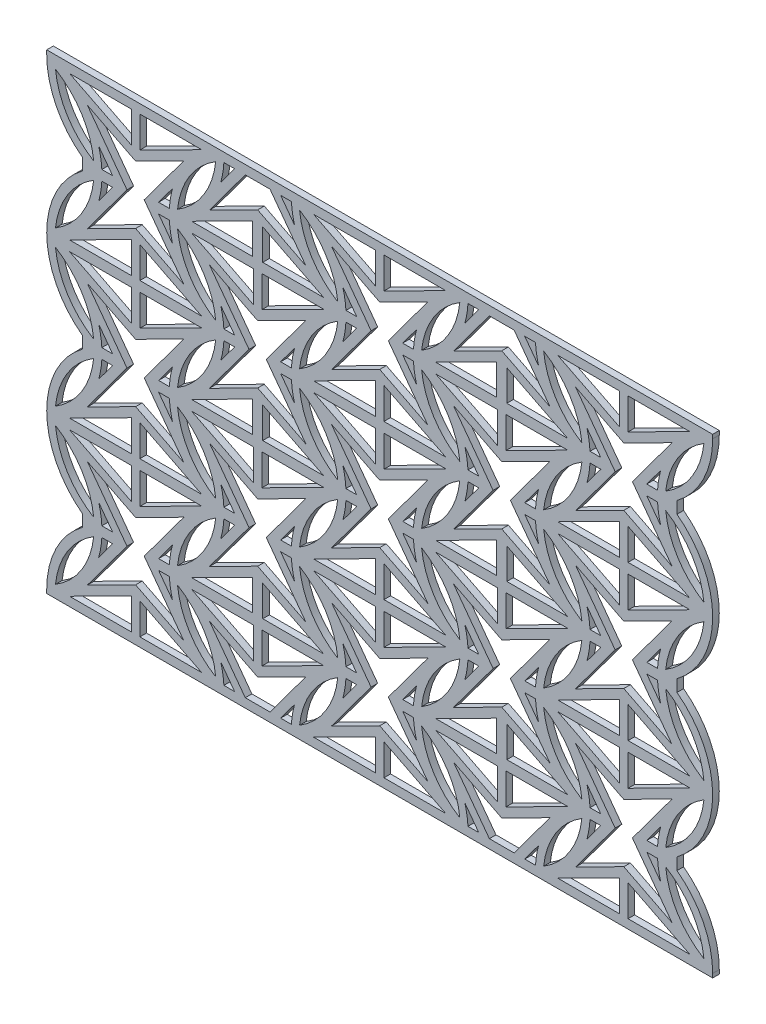
from build123d import *

# Parameters (mm, degrees)
BOSS_EXTRUDE1_DEPTH = 1.2


with BuildPart() as part:
    # Sketch1 → Boss-Extrude1 (new body)
    with BuildSketch(Plane.XY):
        with BuildLine():
            Line((-15.727929803, -12.952946495), (-15.727929803, -13.669398148))
            Line((-15.727929803, -13.669398148), (16.472070197, -13.669398148))
            Line((16.472070197, -13.669398148), (28.486967137, -13.669398148))
            Line((28.486967137, -13.669398148), (60.686967137, -13.669398148))
            Line((60.686967137, -13.669398148), (72.701864078, -13.669398148))
            Line((72.701864078, -13.669398148), (104.901864078, -13.669398148))
            Line((104.901864078, -13.669398148), (104.901864078, -12.952946495))
            ThreePointArc((104.901864078, -12.952946495), (103.196137283, -5.740810966), (98.440385953, -0.056865849))
            Line((98.440385953, -0.056865849), (98.440385953, 2.103251931))
            ThreePointArc((98.440385953, 2.103251931), (103.196137283, 7.787197048), (104.901864078, 14.999332578))
            ThreePointArc((104.901864078, 14.999332578), (103.196137283, 22.211468108), (98.440385953, 27.895413225))
            Line((98.440385953, 27.895413225), (98.440385953, 30.055531005))
            ThreePointArc((98.440385953, 30.055531005), (103.196137283, 35.739476122), (104.901864078, 42.951611652))
            ThreePointArc((104.901864078, 42.951611652), (103.196137283, 50.163747182), (98.440385953, 55.847692299))
            Line((98.440385953, 55.847692299), (98.440385953, 58.007810079))
            ThreePointArc((98.440385953, 58.007810079), (103.196137283, 63.691755196), (104.901864078, 70.903890726))
            Line((104.901864078, 70.903890726), (104.901864078, 71.620342378))
            Line((104.901864078, 71.620342378), (72.701864078, 71.620342378))
            Line((72.701864078, 71.620342378), (60.686967137, 71.620342378))
            Line((60.686967137, 71.620342378), (28.486967137, 71.620342378))
            Line((28.486967137, 71.620342378), (16.472070197, 71.620342378))
            Line((16.472070197, 71.620342378), (-15.727929803, 71.620342378))
            Line((-15.727929803, 71.620342378), (-15.727929803, 70.903890726))
            ThreePointArc((-15.727929803, 70.903890726), (-14.022203008, 63.691755196), (-9.266451679, 58.007810079))
            Line((-9.266451679, 58.007810079), (-9.266451679, 55.847692299))
            ThreePointArc((-9.266451679, 55.847692299), (-14.022203008, 50.163747182), (-15.727929803, 42.951611652))
            ThreePointArc((-15.727929803, 42.951611652), (-14.022203008, 35.739476122), (-9.266451679, 30.055531005))
            Line((-9.266451679, 30.055531005), (-9.266451679, 27.895413225))
            ThreePointArc((-9.266451679, 27.895413225), (-14.022203008, 22.211468108), (-15.727929803, 14.999332578))
            ThreePointArc((-15.727929803, 14.999332578), (-14.022203008, 7.787197048), (-9.266451679, 2.103251931))
            Line((-9.266451679, 2.103251931), (-9.266451679, -0.056865849))
            ThreePointArc((-9.266451679, -0.056865849), (-14.022203008, -5.740810966), (-15.727929803, -12.952946495))
        make_face()
        with BuildLine():
            Line((4.538204286, 0.10466102), (6.487112113, 0.10466102))
            ThreePointArc((6.487112113, 0.10466102), (6.678500428, -1.609028658), (7.052983066, -3.292217463))
            Line((7.052983066, -3.292217463), (4.538204286, 0.10466102))
        make_face(mode=Mode.SUBTRACT)
        with BuildLine():
            Line((-3.794063892, 0.10466102), (-5.742971719, 0.10466102))
            ThreePointArc((-5.742971719, 0.10466102), (-5.934360034, -1.609028658), (-6.308842672, -3.292217463))
            Line((-6.308842672, -3.292217463), (-3.794063892, 0.10466102))
        make_face(mode=Mode.SUBTRACT)
        with BuildLine():
            Line((-3.794063892, 1.941725063), (-6.308842672, 5.338603546))
            ThreePointArc((-6.308842672, 5.338603546), (-5.934360034, 3.655414741), (-5.742971719, 1.941725063))
            Line((-5.742971719, 1.941725063), (-3.794063892, 1.941725063))
        make_face(mode=Mode.SUBTRACT)
        Polygon((12.336113287, 14.080800557), (1.145509973, 14.080800557), (1.145509973, 8.42883026), align=None, mode=Mode.SUBTRACT)
        with BuildLine():
            Line((4.538204286, 1.941725063), (7.052983066, 5.338603546))
            ThreePointArc((7.052983066, 5.338603546), (6.678500428, 3.655414741), (6.487112113, 1.941725063))
            Line((6.487112113, 1.941725063), (4.538204286, 1.941725063))
        make_face(mode=Mode.SUBTRACT)
        Polygon((-0.401369579, 8.42883026), (-11.591972894, 14.080800557), (-0.401369579, 14.080800557), align=None, mode=Mode.SUBTRACT)
        Polygon((0.372070197, 6.305212458), (9.111793427, 10.719331582), (1.933543286, 1.023193041), (9.111793427, -8.6729455), (0.372070197, -4.258826375), (-8.367653033, -8.6729455), (-1.189402892, 1.023193041), (-8.367653033, 10.719331582), align=None, mode=Mode.SUBTRACT)
        Polygon((21.706078891, 22.404969797), (10.515475577, 28.056940094), (21.706078891, 28.056940094), align=None, mode=Mode.SUBTRACT)
        Polygon((22.479518667, 20.281351995), (13.739795437, 24.695471119), (20.918045578, 14.999332578), (13.739795437, 5.303194037), (22.479518667, 9.717313161), (31.219241897, 5.303194037), (24.040991756, 14.999332578), (31.219241897, 24.695471119), align=None, mode=Mode.SUBTRACT)
        with BuildLine():
            Line((26.645652756, 15.9178646), (29.160431536, 19.314743083))
            ThreePointArc((29.160431536, 19.314743083), (28.785948898, 17.631554278), (28.594560583, 15.9178646))
            Line((28.594560583, 15.9178646), (26.645652756, 15.9178646))
        make_face(mode=Mode.SUBTRACT)
        with BuildLine():
            Line((18.313384578, 15.9178646), (15.798605798, 19.314743083))
            ThreePointArc((15.798605798, 19.314743083), (16.173088436, 17.631554278), (16.364476751, 15.9178646))
            Line((16.364476751, 15.9178646), (18.313384578, 15.9178646))
        make_face(mode=Mode.SUBTRACT)
        Polygon((23.402958443, 7.517935768), (34.443561758, 1.941725063), (23.402958443, 1.941725063), align=None, mode=Mode.SUBTRACT)
        with BuildLine():
            Line((18.313384578, 14.080800557), (16.364476751, 14.080800557))
            ThreePointArc((16.364476751, 14.080800557), (16.173088436, 12.367110879), (15.798605798, 10.683922074))
            Line((15.798605798, 10.683922074), (18.313384578, 14.080800557))
        make_face(mode=Mode.SUBTRACT)
        Polygon((21.556078891, 2.103251931), (21.556078891, 1.941725063), (10.515475577, 1.941725063), (21.556078891, 7.517935768), align=None, mode=Mode.SUBTRACT)
        with BuildLine():
            Line((26.645652756, 14.080800557), (28.594560583, 14.080800557))
            ThreePointArc((28.594560583, 14.080800557), (28.785948898, 12.367110879), (29.160431536, 10.683922074))
            Line((29.160431536, 10.683922074), (26.645652756, 14.080800557))
        make_face(mode=Mode.SUBTRACT)
        Polygon((23.252958443, 28.056940094), (23.252958443, 22.404969797), (34.443561758, 28.056940094), align=None, mode=Mode.SUBTRACT)
        Polygon((43.813527361, 36.381109333), (32.622924047, 42.033079631), (43.813527361, 42.033079631), align=None, mode=Mode.SUBTRACT)
        Polygon((44.586967137, 34.257491532), (35.847243907, 38.671610656), (43.025494048, 28.975472115), (35.847243907, 19.279333574), (44.586967137, 23.693452698), (53.326690368, 19.279333574), (46.148440226, 28.975472115), (53.326690368, 38.671610656), align=None, mode=Mode.SUBTRACT)
        with BuildLine():
            Line((48.753101226, 29.894004137), (51.267880006, 33.29088262))
            ThreePointArc((51.267880006, 33.29088262), (50.893397368, 31.607693815), (50.702009053, 29.894004137))
            Line((50.702009053, 29.894004137), (48.753101226, 29.894004137))
        make_face(mode=Mode.SUBTRACT)
        with BuildLine():
            Line((40.420833048, 29.894004137), (37.906054268, 33.29088262))
            ThreePointArc((37.906054268, 33.29088262), (38.280536906, 31.607693815), (38.471925222, 29.894004137))
            Line((38.471925222, 29.894004137), (40.420833048, 29.894004137))
        make_face(mode=Mode.SUBTRACT)
        with BuildLine():
            Line((40.420833048, 28.056940094), (38.471925222, 28.056940094))
            ThreePointArc((38.471925222, 28.056940094), (38.280536906, 26.343250416), (37.906054268, 24.66006161))
            Line((37.906054268, 24.66006161), (40.420833048, 28.056940094))
        make_face(mode=Mode.SUBTRACT)
        with BuildLine():
            Line((48.753101226, 28.056940094), (50.702009053, 28.056940094))
            ThreePointArc((50.702009053, 28.056940094), (50.893397368, 26.343250416), (51.267880006, 24.66006161))
            Line((51.267880006, 24.66006161), (48.753101226, 28.056940094))
        make_face(mode=Mode.SUBTRACT)
        Polygon((45.360406913, 42.033079631), (45.360406913, 36.381109333), (56.551010228, 42.033079631), align=None, mode=Mode.SUBTRACT)
        Polygon((66.694415608, 37.669592235), (75.434138838, 33.255473111), (68.255888697, 42.951611652), (75.434138838, 52.647750193), (66.694415608, 48.233631069), (57.954692377, 52.647750193), (65.132942518, 42.951611652), (57.954692377, 33.255473111), align=None, mode=Mode.SUBTRACT)
        Polygon((65.920975832, 56.009219167), (65.920975832, 50.35724887), (54.730372517, 56.009219167), align=None, mode=Mode.SUBTRACT)
        with BuildLine():
            Line((70.860549696, 43.870143674), (73.375328477, 47.267022157))
            ThreePointArc((73.375328477, 47.267022157), (73.000845838, 45.583833352), (72.809457523, 43.870143674))
            Line((72.809457523, 43.870143674), (70.860549696, 43.870143674))
        make_face(mode=Mode.SUBTRACT)
        Polygon((65.770975832, 35.470214842), (54.730372517, 29.894004137), (65.770975832, 29.894004137), (65.770975832, 30.055531005), align=None, mode=Mode.SUBTRACT)
        with BuildLine():
            Line((62.528281519, 42.033079631), (60.013502738, 38.636201147))
            ThreePointArc((60.013502738, 38.636201147), (60.387985377, 40.319389952), (60.579373692, 42.033079631))
            Line((60.579373692, 42.033079631), (62.528281519, 42.033079631))
        make_face(mode=Mode.SUBTRACT)
        Polygon((78.658458698, 56.009219167), (67.467855383, 56.009219167), (67.467855383, 50.35724887), align=None, mode=Mode.SUBTRACT)
        with BuildLine():
            Line((62.528281519, 43.870143674), (60.013502738, 47.267022157))
            ThreePointArc((60.013502738, 47.267022157), (60.387985377, 45.583833352), (60.579373692, 43.870143674))
            Line((60.579373692, 43.870143674), (62.528281519, 43.870143674))
        make_face(mode=Mode.SUBTRACT)
        Polygon((78.658458698, 29.894004137), (67.617855383, 29.894004137), (67.617855383, 35.470214842), align=None, mode=Mode.SUBTRACT)
        with BuildLine():
            Line((70.860549696, 42.033079631), (72.809457523, 42.033079631))
            ThreePointArc((72.809457523, 42.033079631), (73.000845838, 40.319389952), (73.375328477, 38.636201147))
            Line((73.375328477, 38.636201147), (70.860549696, 42.033079631))
        make_face(mode=Mode.SUBTRACT)
        with BuildLine():
            Line((26.645652756, 43.870143674), (29.160431536, 47.267022157))
            ThreePointArc((29.160431536, 47.267022157), (28.785948898, 45.583833352), (28.594560583, 43.870143674))
            Line((28.594560583, 43.870143674), (26.645652756, 43.870143674))
        make_face(mode=Mode.SUBTRACT)
        with BuildLine():
            Line((26.645652756, 42.033079631), (29.160431536, 38.636201147))
            ThreePointArc((29.160431536, 38.636201147), (28.785948898, 40.319389952), (28.594560583, 42.033079631))
            Line((28.594560583, 42.033079631), (26.645652756, 42.033079631))
        make_face(mode=Mode.SUBTRACT)
        Polygon((21.556078891, 30.055531005), (21.556078891, 29.894004137), (10.515475577, 29.894004137), (21.556078891, 35.470214842), align=None, mode=Mode.SUBTRACT)
        Polygon((23.402958443, 35.470214842), (23.402958443, 29.894004137), (34.443561758, 29.894004137), align=None, mode=Mode.SUBTRACT)
        Polygon((23.252958443, 50.35724887), (34.443561758, 56.009219167), (23.252958443, 56.009219167), align=None, mode=Mode.SUBTRACT)
        Polygon((22.479518667, 37.669592235), (31.219241897, 33.255473111), (24.040991756, 42.951611652), (31.219241897, 52.647750193), (22.479518667, 48.233631069), (13.739795437, 52.647750193), (20.918045578, 42.951611652), (13.739795437, 33.255473111), align=None, mode=Mode.SUBTRACT)
        Polygon((21.706078891, 50.35724887), (10.515475577, 56.009219167), (21.706078891, 56.009219167), align=None, mode=Mode.SUBTRACT)
        with BuildLine():
            Line((18.313384578, 42.033079631), (16.364476751, 42.033079631))
            ThreePointArc((16.364476751, 42.033079631), (16.173088436, 40.319389952), (15.798605798, 38.636201147))
            Line((15.798605798, 38.636201147), (18.313384578, 42.033079631))
        make_face(mode=Mode.SUBTRACT)
        with BuildLine():
            Line((18.313384578, 43.870143674), (16.364476751, 43.870143674))
            ThreePointArc((16.364476751, 43.870143674), (16.173088436, 45.583833352), (15.798605798, 47.267022157))
            Line((15.798605798, 47.267022157), (18.313384578, 43.870143674))
        make_face(mode=Mode.SUBTRACT)
        with BuildLine():
            Line((4.538204286, 29.894004137), (7.052983066, 33.29088262))
            ThreePointArc((7.052983066, 33.29088262), (6.678500428, 31.607693815), (6.487112113, 29.894004137))
            Line((6.487112113, 29.894004137), (4.538204286, 29.894004137))
        make_face(mode=Mode.SUBTRACT)
        with BuildLine():
            Line((4.538204286, 28.056940094), (7.052983066, 24.66006161))
            ThreePointArc((7.052983066, 24.66006161), (6.678500428, 26.343250416), (6.487112113, 28.056940094))
            Line((6.487112113, 28.056940094), (4.538204286, 28.056940094))
        make_face(mode=Mode.SUBTRACT)
        Polygon((1.145509973, 36.381109333), (12.336113287, 42.033079631), (1.145509973, 42.033079631), align=None, mode=Mode.SUBTRACT)
        Polygon((0.372070197, 23.693452698), (9.111793427, 19.279333574), (1.933543286, 28.975472115), (9.111793427, 38.671610656), (0.372070197, 34.257491532), (-8.367653033, 38.671610656), (-1.189402892, 28.975472115), (-8.367653033, 19.279333574), align=None, mode=Mode.SUBTRACT)
        Polygon((-0.401369579, 36.381109333), (-11.591972894, 42.033079631), (-0.401369579, 42.033079631), align=None, mode=Mode.SUBTRACT)
        with BuildLine():
            Line((-3.794063892, 28.056940094), (-5.742971719, 28.056940094))
            ThreePointArc((-5.742971719, 28.056940094), (-5.934360034, 26.343250416), (-6.308842672, 24.66006161))
            Line((-6.308842672, 24.66006161), (-3.794063892, 28.056940094))
        make_face(mode=Mode.SUBTRACT)
        with BuildLine():
            Line((-3.794063892, 29.894004137), (-5.742971719, 29.894004137))
            ThreePointArc((-5.742971719, 29.894004137), (-5.934360034, 31.607693815), (-6.308842672, 33.29088262))
            Line((-6.308842672, 33.29088262), (-3.794063892, 29.894004137))
        make_face(mode=Mode.SUBTRACT)
        with BuildLine():
            Line((48.753101226, 57.84628321), (51.267880006, 61.243161694))
            ThreePointArc((51.267880006, 61.243161694), (50.893397368, 59.559972889), (50.702009053, 57.84628321))
            Line((50.702009053, 57.84628321), (48.753101226, 57.84628321))
        make_face(mode=Mode.SUBTRACT)
        with BuildLine():
            Line((48.753101226, 56.009219167), (51.267880006, 52.612340684))
            ThreePointArc((51.267880006, 52.612340684), (50.893397368, 54.295529489), (50.702009053, 56.009219167))
            Line((50.702009053, 56.009219167), (48.753101226, 56.009219167))
        make_face(mode=Mode.SUBTRACT)
        Polygon((45.360406913, 64.333388407), (56.551010228, 69.985358704), (45.360406913, 69.985358704), align=None, mode=Mode.SUBTRACT)
        Polygon((44.586967137, 51.645731772), (53.326690368, 47.231612648), (46.148440226, 56.927751189), (53.326690368, 66.62388973), (44.586967137, 62.209770606), (35.847243907, 66.62388973), (43.025494048, 56.927751189), (35.847243907, 47.231612648), align=None, mode=Mode.SUBTRACT)
        Polygon((43.813527361, 64.333388407), (32.622924047, 69.985358704), (43.813527361, 69.985358704), align=None, mode=Mode.SUBTRACT)
        with BuildLine():
            Line((40.420833048, 56.009219167), (38.471925222, 56.009219167))
            ThreePointArc((38.471925222, 56.009219167), (38.280536906, 54.295529489), (37.906054268, 52.612340684))
            Line((37.906054268, 52.612340684), (40.420833048, 56.009219167))
        make_face(mode=Mode.SUBTRACT)
        with BuildLine():
            Line((40.420833048, 57.84628321), (38.471925222, 57.84628321))
            ThreePointArc((38.471925222, 57.84628321), (38.280536906, 59.559972889), (37.906054268, 61.243161694))
            Line((37.906054268, 61.243161694), (40.420833048, 57.84628321))
        make_face(mode=Mode.SUBTRACT)
        with BuildLine():
            Line((4.538204286, 57.84628321), (7.052983066, 61.243161694))
            ThreePointArc((7.052983066, 61.243161694), (6.678500428, 59.559972889), (6.487112113, 57.84628321))
            Line((6.487112113, 57.84628321), (4.538204286, 57.84628321))
        make_face(mode=Mode.SUBTRACT)
        with BuildLine():
            Line((4.538204286, 56.009219167), (7.052983066, 52.612340684))
            ThreePointArc((7.052983066, 52.612340684), (6.678500428, 54.295529489), (6.487112113, 56.009219167))
            Line((6.487112113, 56.009219167), (4.538204286, 56.009219167))
        make_face(mode=Mode.SUBTRACT)
        Polygon((1.145509973, 64.333388407), (12.336113287, 69.985358704), (1.145509973, 69.985358704), align=None, mode=Mode.SUBTRACT)
        Polygon((0.372070197, 51.645731772), (9.111793427, 47.231612648), (1.933543286, 56.927751189), (9.111793427, 66.62388973), (0.372070197, 62.209770606), (-8.367653033, 66.62388973), (-1.189402892, 56.927751189), (-8.367653033, 47.231612648), align=None, mode=Mode.SUBTRACT)
        Polygon((-0.401369579, 64.333388407), (-11.591972894, 69.985358704), (-0.401369579, 69.985358704), align=None, mode=Mode.SUBTRACT)
        with BuildLine():
            Line((-3.794063892, 56.009219167), (-5.742971719, 56.009219167))
            ThreePointArc((-5.742971719, 56.009219167), (-5.934360034, 54.295529489), (-6.308842672, 52.612340684))
            Line((-6.308842672, 52.612340684), (-3.794063892, 56.009219167))
        make_face(mode=Mode.SUBTRACT)
        with BuildLine():
            Line((-3.794063892, 57.84628321), (-5.742971719, 57.84628321))
            ThreePointArc((-5.742971719, 57.84628321), (-5.934360034, 59.559972889), (-6.308842672, 61.243161694))
            Line((-6.308842672, 61.243161694), (-3.794063892, 57.84628321))
        make_face(mode=Mode.SUBTRACT)
        with BuildLine():
            Line((26.645652756, 69.985358704), (29.160431536, 66.588480221))
            ThreePointArc((29.160431536, 66.588480221), (28.785948898, 68.271669026), (28.594560583, 69.985358704))
            Line((28.594560583, 69.985358704), (26.645652756, 69.985358704))
        make_face(mode=Mode.SUBTRACT)
        Polygon((21.556078891, 58.007810079), (21.556078891, 57.84628321), (10.515475577, 57.84628321), (21.556078891, 63.422493915), align=None, mode=Mode.SUBTRACT)
        Polygon((23.402958443, 63.422493915), (23.402958443, 57.84628321), (34.443561758, 57.84628321), align=None, mode=Mode.SUBTRACT)
        Polygon((22.479518667, 65.621871309), (31.219241897, 61.207752185), (24.720999842, 69.985358704), (20.238037492, 69.985358704), (13.739795437, 61.207752185), align=None, mode=Mode.SUBTRACT)
        with BuildLine():
            Line((18.313384578, 69.985358704), (16.364476751, 69.985358704))
            ThreePointArc((16.364476751, 69.985358704), (16.173088436, 68.271669026), (15.798605798, 66.588480221))
            Line((15.798605798, 66.588480221), (18.313384578, 69.985358704))
        make_face(mode=Mode.SUBTRACT)
        Polygon((53.326690368, 10.719331582), (46.148440226, 1.023193041), (53.326690368, -8.6729455), (44.586967137, -4.258826375), (35.847243907, -8.6729455), (43.025494048, 1.023193041), (35.847243907, 10.719331582), (44.586967137, 6.305212458), align=None, mode=Mode.SUBTRACT)
        with BuildLine():
            Line((40.420833048, 0.10466102), (37.906054268, -3.292217463))
            ThreePointArc((37.906054268, -3.292217463), (38.280536906, -1.609028658), (38.471925222, 0.10466102))
            Line((38.471925222, 0.10466102), (40.420833048, 0.10466102))
        make_face(mode=Mode.SUBTRACT)
        Polygon((43.813527361, 8.42883026), (32.622924047, 14.080800557), (43.813527361, 14.080800557), align=None, mode=Mode.SUBTRACT)
        with BuildLine():
            Line((48.753101226, 0.10466102), (51.267880006, -3.292217463))
            ThreePointArc((51.267880006, -3.292217463), (50.893397368, -1.609028658), (50.702009053, 0.10466102))
            Line((50.702009053, 0.10466102), (48.753101226, 0.10466102))
        make_face(mode=Mode.SUBTRACT)
        Polygon((45.360406913, 8.42883026), (56.551010228, 14.080800557), (45.360406913, 14.080800557), align=None, mode=Mode.SUBTRACT)
        with BuildLine():
            Line((40.420833048, 1.941725063), (37.906054268, 5.338603546))
            ThreePointArc((37.906054268, 5.338603546), (38.280536906, 3.655414741), (38.471925222, 1.941725063))
            Line((38.471925222, 1.941725063), (40.420833048, 1.941725063))
        make_face(mode=Mode.SUBTRACT)
        with BuildLine():
            Line((48.753101226, 1.941725063), (50.702009053, 1.941725063))
            ThreePointArc((50.702009053, 1.941725063), (50.893397368, 3.655414741), (51.267880006, 5.338603546))
            Line((51.267880006, 5.338603546), (48.753101226, 1.941725063))
        make_face(mode=Mode.SUBTRACT)
        Polygon((75.434138838, 24.695471119), (68.255888697, 14.999332578), (75.434138838, 5.303194037), (66.694415608, 9.717313161), (57.954692377, 5.303194037), (65.132942518, 14.999332578), (57.954692377, 24.695471119), (66.694415608, 20.281351995), align=None, mode=Mode.SUBTRACT)
        with BuildLine():
            Line((62.528281519, 14.080800557), (60.013502738, 10.683922074))
            ThreePointArc((60.013502738, 10.683922074), (60.387985377, 12.367110879), (60.579373692, 14.080800557))
            Line((60.579373692, 14.080800557), (62.528281519, 14.080800557))
        make_face(mode=Mode.SUBTRACT)
        Polygon((65.920975832, 22.404969797), (54.730372517, 28.056940094), (65.920975832, 28.056940094), align=None, mode=Mode.SUBTRACT)
        Polygon((67.617855383, 7.517935768), (78.658458698, 1.941725063), (67.617855383, 1.941725063), align=None, mode=Mode.SUBTRACT)
        with BuildLine():
            Line((70.860549696, 14.080800557), (73.375328477, 10.683922074))
            ThreePointArc((73.375328477, 10.683922074), (73.000845838, 12.367110879), (72.809457523, 14.080800557))
            Line((72.809457523, 14.080800557), (70.860549696, 14.080800557))
        make_face(mode=Mode.SUBTRACT)
        Polygon((67.467855383, 22.404969797), (78.658458698, 28.056940094), (67.467855383, 28.056940094), align=None, mode=Mode.SUBTRACT)
        with BuildLine():
            Line((62.528281519, 15.9178646), (60.013502738, 19.314743083))
            ThreePointArc((60.013502738, 19.314743083), (60.387985377, 17.631554278), (60.579373692, 15.9178646))
            Line((60.579373692, 15.9178646), (62.528281519, 15.9178646))
        make_face(mode=Mode.SUBTRACT)
        with BuildLine():
            Line((70.860549696, 15.9178646), (72.809457523, 15.9178646))
            ThreePointArc((72.809457523, 15.9178646), (73.000845838, 17.631554278), (73.375328477, 19.314743083))
            Line((73.375328477, 19.314743083), (70.860549696, 15.9178646))
        make_face(mode=Mode.SUBTRACT)
        Polygon((65.770975832, 1.941725063), (54.730372517, 1.941725063), (65.770975832, 7.517935768), (65.770975832, 2.103251931), align=None, mode=Mode.SUBTRACT)
        Polygon((66.694415608, 65.621871309), (57.954692377, 61.207752185), (64.452934432, 69.985358704), (68.935896783, 69.985358704), (75.434138838, 61.207752185), align=None, mode=Mode.SUBTRACT)
        with BuildLine():
            Line((70.860549696, 69.985358704), (73.375328477, 66.588480221))
            ThreePointArc((73.375328477, 66.588480221), (73.000845838, 68.271669026), (72.809457523, 69.985358704))
            Line((72.809457523, 69.985358704), (70.860549696, 69.985358704))
        make_face(mode=Mode.SUBTRACT)
        with BuildLine():
            Line((62.528281519, 69.985358704), (60.013502738, 66.588480221))
            ThreePointArc((60.013502738, 66.588480221), (60.387985377, 68.271669026), (60.579373692, 69.985358704))
            Line((60.579373692, 69.985358704), (62.528281519, 69.985358704))
        make_face(mode=Mode.SUBTRACT)
        Polygon((67.617855383, 63.422493915), (78.658458698, 57.84628321), (67.617855383, 57.84628321), align=None, mode=Mode.SUBTRACT)
        Polygon((65.770975832, 63.422493915), (65.770975832, 58.007810079), (65.770975832, 57.84628321), (54.730372517, 57.84628321), align=None, mode=Mode.SUBTRACT)
        Polygon((89.575303854, 42.033079631), (89.575303854, 36.381109333), (100.765907168, 42.033079631), align=None, mode=Mode.SUBTRACT)
        with BuildLine():
            Line((84.635729989, 29.894004137), (82.120951209, 33.29088262))
            ThreePointArc((82.120951209, 33.29088262), (82.495433847, 31.607693815), (82.686822162, 29.894004137))
            Line((82.686822162, 29.894004137), (84.635729989, 29.894004137))
        make_face(mode=Mode.SUBTRACT)
        with BuildLine():
            Line((92.967998167, 29.894004137), (94.916905994, 29.894004137))
            ThreePointArc((94.916905994, 29.894004137), (95.108294309, 31.607693815), (95.482776947, 33.29088262))
            Line((95.482776947, 33.29088262), (92.967998167, 29.894004137))
        make_face(mode=Mode.SUBTRACT)
        Polygon((88.801864078, 34.257491532), (80.062140848, 38.671610656), (87.240390989, 28.975472115), (80.062140848, 19.279333574), (88.801864078, 23.693452698), (97.541587308, 19.279333574), (90.363337167, 28.975472115), (97.541587308, 38.671610656), align=None, mode=Mode.SUBTRACT)
        Polygon((88.028424302, 42.033079631), (88.028424302, 36.381109333), (76.837820987, 42.033079631), align=None, mode=Mode.SUBTRACT)
        with BuildLine():
            Line((84.635729989, 28.056940094), (82.686822162, 28.056940094))
            ThreePointArc((82.686822162, 28.056940094), (82.495433847, 26.343250416), (82.120951209, 24.66006161))
            Line((82.120951209, 24.66006161), (84.635729989, 28.056940094))
        make_face(mode=Mode.SUBTRACT)
        with BuildLine():
            Line((92.967998167, 28.056940094), (94.916905994, 28.056940094))
            ThreePointArc((94.916905994, 28.056940094), (95.108294309, 26.343250416), (95.482776947, 24.66006161))
            Line((95.482776947, 24.66006161), (92.967998167, 28.056940094))
        make_face(mode=Mode.SUBTRACT)
        Polygon((89.575303854, 69.985358704), (89.575303854, 64.333388407), (100.765907168, 69.985358704), align=None, mode=Mode.SUBTRACT)
        with BuildLine():
            Line((84.635729989, 57.84628321), (82.120951209, 61.243161694))
            ThreePointArc((82.120951209, 61.243161694), (82.495433847, 59.559972889), (82.686822162, 57.84628321))
            Line((82.686822162, 57.84628321), (84.635729989, 57.84628321))
        make_face(mode=Mode.SUBTRACT)
        with BuildLine():
            Line((92.967998167, 57.84628321), (94.916905994, 57.84628321))
            ThreePointArc((94.916905994, 57.84628321), (95.108294309, 59.559972889), (95.482776947, 61.243161694))
            Line((95.482776947, 61.243161694), (92.967998167, 57.84628321))
        make_face(mode=Mode.SUBTRACT)
        Polygon((88.801864078, 62.209770606), (80.062140848, 66.62388973), (87.240390989, 56.927751189), (80.062140848, 47.231612648), (88.801864078, 51.645731772), (97.541587308, 47.231612648), (90.363337167, 56.927751189), (97.541587308, 66.62388973), align=None, mode=Mode.SUBTRACT)
        Polygon((88.028424302, 69.985358704), (88.028424302, 64.333388407), (76.837820987, 69.985358704), align=None, mode=Mode.SUBTRACT)
        with BuildLine():
            Line((84.635729989, 56.009219167), (82.686822162, 56.009219167))
            ThreePointArc((82.686822162, 56.009219167), (82.495433847, 54.295529489), (82.120951209, 52.612340684))
            Line((82.120951209, 52.612340684), (84.635729989, 56.009219167))
        make_face(mode=Mode.SUBTRACT)
        with BuildLine():
            Line((92.967998167, 56.009219167), (94.916905994, 56.009219167))
            ThreePointArc((94.916905994, 56.009219167), (95.108294309, 54.295529489), (95.482776947, 52.612340684))
            Line((95.482776947, 52.612340684), (92.967998167, 56.009219167))
        make_face(mode=Mode.SUBTRACT)
        with BuildLine():
            Line((84.635729989, 0.10466102), (82.686822162, 0.10466102))
            ThreePointArc((82.686822162, 0.10466102), (82.495433847, -1.609028658), (82.120951209, -3.292217463))
            Line((82.120951209, -3.292217463), (84.635729989, 0.10466102))
        make_face(mode=Mode.SUBTRACT)
        Polygon((89.575303854, 8.42883026), (100.765907168, 14.080800557), (89.575303854, 14.080800557), align=None, mode=Mode.SUBTRACT)
        Polygon((97.541587308, -8.6729455), (90.363337167, 1.023193041), (97.541587308, 10.719331582), (88.801864078, 6.305212458), (80.062140848, 10.719331582), (87.240390989, 1.023193041), (80.062140848, -8.6729455), (88.801864078, -4.258826375), align=None, mode=Mode.SUBTRACT)
        with BuildLine():
            Line((92.967998167, 0.10466102), (95.482776947, -3.292217463))
            ThreePointArc((95.482776947, -3.292217463), (95.108294309, -1.609028658), (94.916905994, 0.10466102))
            Line((94.916905994, 0.10466102), (92.967998167, 0.10466102))
        make_face(mode=Mode.SUBTRACT)
        with BuildLine():
            Line((84.635729989, 1.941725063), (82.120951209, 5.338603546))
            ThreePointArc((82.120951209, 5.338603546), (82.495433847, 3.655414741), (82.686822162, 1.941725063))
            Line((82.686822162, 1.941725063), (84.635729989, 1.941725063))
        make_face(mode=Mode.SUBTRACT)
        with BuildLine():
            Line((92.967998167, 1.941725063), (94.916905994, 1.941725063))
            ThreePointArc((94.916905994, 1.941725063), (95.108294309, 3.655414741), (95.482776947, 5.338603546))
            Line((95.482776947, 5.338603546), (92.967998167, 1.941725063))
        make_face(mode=Mode.SUBTRACT)
        Polygon((88.028424302, 14.080800557), (76.837820987, 14.080800557), (88.028424302, 8.42883026), align=None, mode=Mode.SUBTRACT)
        Polygon((67.467855383, -5.547309277), (78.658458698, 0.10466102), (67.467855383, 0.10466102), align=None, mode=Mode.SUBTRACT)
        Polygon((66.694415608, -7.670927079), (75.434138838, -3.256807954), (68.935896783, -12.034414474), (64.452934432, -12.034414474), (57.954692377, -3.256807954), align=None, mode=Mode.SUBTRACT)
        with BuildLine():
            Line((62.528281519, -12.034414474), (60.013502738, -8.637535991))
            ThreePointArc((60.013502738, -8.637535991), (60.387985377, -10.320724796), (60.579373692, -12.034414474))
            Line((60.579373692, -12.034414474), (62.528281519, -12.034414474))
        make_face(mode=Mode.SUBTRACT)
        with BuildLine():
            Line((70.860549696, -12.034414474), (72.809457523, -12.034414474))
            ThreePointArc((72.809457523, -12.034414474), (73.000845838, -10.320724796), (73.375328477, -8.637535991))
            Line((73.375328477, -8.637535991), (70.860549696, -12.034414474))
        make_face(mode=Mode.SUBTRACT)
        Polygon((65.920975832, 0.10466102), (54.730372517, 0.10466102), (65.920975832, -5.547309277), align=None, mode=Mode.SUBTRACT)
        Polygon((23.252958443, -5.547309277), (34.443561758, 0.10466102), (23.252958443, 0.10466102), align=None, mode=Mode.SUBTRACT)
        Polygon((22.479518667, -7.670927079), (31.219241897, -3.256807954), (24.720999842, -12.034414474), (20.238037492, -12.034414474), (13.739795437, -3.256807954), align=None, mode=Mode.SUBTRACT)
        with BuildLine():
            Line((18.313384578, -12.034414474), (15.798605798, -8.637535991))
            ThreePointArc((15.798605798, -8.637535991), (16.173088436, -10.320724796), (16.364476751, -12.034414474))
            Line((16.364476751, -12.034414474), (18.313384578, -12.034414474))
        make_face(mode=Mode.SUBTRACT)
        with BuildLine():
            Line((26.645652756, -12.034414474), (28.594560583, -12.034414474))
            ThreePointArc((28.594560583, -12.034414474), (28.785948898, -10.320724796), (29.160431536, -8.637535991))
            Line((29.160431536, -8.637535991), (26.645652756, -12.034414474))
        make_face(mode=Mode.SUBTRACT)
        Polygon((21.706078891, 0.10466102), (10.515475577, 0.10466102), (21.706078891, -5.547309277), align=None, mode=Mode.SUBTRACT)
        Polygon((89.575303854, -12.034414474), (89.575303854, -6.382444177), (100.765907168, -12.034414474), align=None, mode=Mode.SUBTRACT)
        Polygon((88.028424302, -12.034414474), (88.028424302, -6.382444177), (76.837820987, -12.034414474), align=None, mode=Mode.SUBTRACT)
        Polygon((45.360406913, -12.034414474), (45.360406913, -6.382444177), (56.551010228, -12.034414474), align=None, mode=Mode.SUBTRACT)
        Polygon((43.813527361, -12.034414474), (43.813527361, -6.382444177), (32.622924047, -12.034414474), align=None, mode=Mode.SUBTRACT)
        Polygon((1.145509973, -6.382444177), (12.336113287, -12.034414474), (1.145509973, -12.034414474), align=None, mode=Mode.SUBTRACT)
        Polygon((-0.401369579, -12.034414474), (-0.401369579, -6.382444177), (-11.591972894, -12.034414474), align=None, mode=Mode.SUBTRACT)
        Polygon((100.765907168, 15.9178646), (89.575303854, 15.9178646), (89.575303854, 21.569834897), align=None, mode=Mode.SUBTRACT)
        Polygon((88.028424302, 15.9178646), (76.837820987, 15.9178646), (88.028424302, 21.569834897), align=None, mode=Mode.SUBTRACT)
        Polygon((56.551010228, 15.9178646), (45.360406913, 15.9178646), (45.360406913, 21.569834897), align=None, mode=Mode.SUBTRACT)
        Polygon((43.813527361, 15.9178646), (43.813527361, 21.569834897), (32.622924047, 15.9178646), align=None, mode=Mode.SUBTRACT)
        Polygon((1.145509973, 15.9178646), (1.145509973, 21.569834897), (12.336113287, 15.9178646), align=None, mode=Mode.SUBTRACT)
        Polygon((-0.401369579, 15.9178646), (-0.401369579, 21.569834897), (-11.591972894, 15.9178646), align=None, mode=Mode.SUBTRACT)
        Polygon((100.765907168, 43.870143674), (89.575303854, 43.870143674), (89.575303854, 49.522113971), align=None, mode=Mode.SUBTRACT)
        Polygon((88.028424302, 43.870143674), (76.837820987, 43.870143674), (88.028424302, 49.522113971), align=None, mode=Mode.SUBTRACT)
        Polygon((45.360406913, 43.870143674), (45.360406913, 49.522113971), (56.551010228, 43.870143674), align=None, mode=Mode.SUBTRACT)
        Polygon((43.813527361, 43.870143674), (43.813527361, 49.522113971), (32.622924047, 43.870143674), align=None, mode=Mode.SUBTRACT)
        Polygon((1.145509973, 43.870143674), (1.145509973, 49.522113971), (12.336113287, 43.870143674), align=None, mode=Mode.SUBTRACT)
        Polygon((-0.401369579, 43.870143674), (-0.401369579, 49.522113971), (-11.591972894, 43.870143674), align=None, mode=Mode.SUBTRACT)
        with BuildLine():
            ThreePointArc((-14.140453598, -11.436003631), (-9.401763675, -6.77401245), (-7.222854479, -0.493749823))
            ThreePointArc((-7.222854479, -0.493749823), (-11.961544402, -5.155741004), (-14.140453598, -11.436003631))
        make_face(mode=Mode.SUBTRACT)
        with BuildLine():
            ThreePointArc((7.966994872, 2.540135906), (12.705684795, 7.202127086), (14.884593992, 13.482389714))
            ThreePointArc((14.884593992, 13.482389714), (10.145904069, 8.820398533), (7.966994872, 2.540135906))
        make_face(mode=Mode.SUBTRACT)
        with BuildLine():
            ThreePointArc((-14.140453598, 13.482389714), (-9.401763675, 8.820398533), (-7.222854479, 2.540135906))
            ThreePointArc((-7.222854479, 2.540135906), (-11.961544402, 7.202127086), (-14.140453598, 13.482389714))
        make_face(mode=Mode.SUBTRACT)
        with BuildLine():
            ThreePointArc((36.992042462, 2.540135906), (32.253352539, 7.202127086), (30.074443343, 13.482389714))
            ThreePointArc((30.074443343, 13.482389714), (34.813133266, 8.820398533), (36.992042462, 2.540135906))
        make_face(mode=Mode.SUBTRACT)
        with BuildLine():
            ThreePointArc((36.992042462, 27.458529251), (32.253352539, 22.79653807), (30.074443343, 16.516275443))
            ThreePointArc((30.074443343, 16.516275443), (34.813133266, 21.178266623), (36.992042462, 27.458529251))
        make_face(mode=Mode.SUBTRACT)
        with BuildLine():
            ThreePointArc((59.099490932, 16.516275443), (54.360801009, 21.178266623), (52.181891813, 27.458529251))
            ThreePointArc((52.181891813, 27.458529251), (56.920581736, 22.79653807), (59.099490932, 16.516275443))
        make_face(mode=Mode.SUBTRACT)
        with BuildLine():
            ThreePointArc((59.099490932, 41.434668788), (54.360801009, 36.772677607), (52.181891813, 30.49241498))
            ThreePointArc((52.181891813, 30.49241498), (56.920581736, 35.15440616), (59.099490932, 41.434668788))
        make_face(mode=Mode.SUBTRACT)
        with BuildLine():
            ThreePointArc((81.206939402, 30.49241498), (76.468249479, 35.15440616), (74.289340283, 41.434668788))
            ThreePointArc((74.289340283, 41.434668788), (79.028030206, 36.772677607), (81.206939402, 30.49241498))
        make_face(mode=Mode.SUBTRACT)
        with BuildLine():
            ThreePointArc((74.289340283, 44.468554517), (79.028030206, 49.130545697), (81.206939402, 55.410808324))
            ThreePointArc((81.206939402, 55.410808324), (76.468249479, 50.748817144), (74.289340283, 44.468554517))
        make_face(mode=Mode.SUBTRACT)
        with BuildLine():
            ThreePointArc((30.074443343, 41.434668788), (34.813133266, 36.772677607), (36.992042462, 30.49241498))
            ThreePointArc((36.992042462, 30.49241498), (32.253352539, 35.15440616), (30.074443343, 41.434668788))
        make_face(mode=Mode.SUBTRACT)
        with BuildLine():
            ThreePointArc((30.074443343, 44.468554517), (34.813133266, 49.130545697), (36.992042462, 55.410808324))
            ThreePointArc((36.992042462, 55.410808324), (32.253352539, 50.748817144), (30.074443343, 44.468554517))
        make_face(mode=Mode.SUBTRACT)
        with BuildLine():
            ThreePointArc((-14.140453598, 41.434668788), (-9.401763675, 36.772677607), (-7.222854479, 30.49241498))
            ThreePointArc((-7.222854479, 30.49241498), (-11.961544402, 35.15440616), (-14.140453598, 41.434668788))
        make_face(mode=Mode.SUBTRACT)
        with BuildLine():
            ThreePointArc((7.966994872, 27.458529251), (12.705684795, 22.79653807), (14.884593992, 16.516275443))
            ThreePointArc((14.884593992, 16.516275443), (10.145904069, 21.178266623), (7.966994872, 27.458529251))
        make_face(mode=Mode.SUBTRACT)
        with BuildLine():
            ThreePointArc((-14.140453598, 16.516275443), (-9.401763675, 21.178266623), (-7.222854479, 27.458529251))
            ThreePointArc((-7.222854479, 27.458529251), (-11.961544402, 22.79653807), (-14.140453598, 16.516275443))
        make_face(mode=Mode.SUBTRACT)
        with BuildLine():
            ThreePointArc((7.966994872, 30.49241498), (12.705684795, 35.15440616), (14.884593992, 41.434668788))
            ThreePointArc((14.884593992, 41.434668788), (10.145904069, 36.772677607), (7.966994872, 30.49241498))
        make_face(mode=Mode.SUBTRACT)
        with BuildLine():
            ThreePointArc((52.181891813, 55.410808324), (56.920581736, 50.748817144), (59.099490932, 44.468554517))
            ThreePointArc((59.099490932, 44.468554517), (54.360801009, 49.130545697), (52.181891813, 55.410808324))
        make_face(mode=Mode.SUBTRACT)
        with BuildLine():
            ThreePointArc((-14.140453598, 69.386947861), (-9.401763675, 64.724956681), (-7.222854479, 58.444694054))
            ThreePointArc((-7.222854479, 58.444694054), (-11.961544402, 63.106685234), (-14.140453598, 69.386947861))
        make_face(mode=Mode.SUBTRACT)
        with BuildLine():
            ThreePointArc((7.966994872, 55.410808324), (12.705684795, 50.748817144), (14.884593992, 44.468554517))
            ThreePointArc((14.884593992, 44.468554517), (10.145904069, 49.130545697), (7.966994872, 55.410808324))
        make_face(mode=Mode.SUBTRACT)
        with BuildLine():
            ThreePointArc((-14.140453598, 44.468554517), (-9.401763675, 49.130545697), (-7.222854479, 55.410808324))
            ThreePointArc((-7.222854479, 55.410808324), (-11.961544402, 50.748817144), (-14.140453598, 44.468554517))
        make_face(mode=Mode.SUBTRACT)
        with BuildLine():
            ThreePointArc((7.966994872, 58.444694054), (12.705684795, 63.106685234), (14.884593992, 69.386947861))
            ThreePointArc((14.884593992, 69.386947861), (10.145904069, 64.724956681), (7.966994872, 58.444694054))
        make_face(mode=Mode.SUBTRACT)
        with BuildLine():
            ThreePointArc((30.074443343, 69.386947861), (34.813133266, 64.724956681), (36.992042462, 58.444694054))
            ThreePointArc((36.992042462, 58.444694054), (32.253352539, 63.106685234), (30.074443343, 69.386947861))
        make_face(mode=Mode.SUBTRACT)
        with BuildLine():
            ThreePointArc((59.099490932, 13.482389714), (54.360801009, 8.820398533), (52.181891813, 2.540135906))
            ThreePointArc((52.181891813, 2.540135906), (56.920581736, 7.202127086), (59.099490932, 13.482389714))
        make_face(mode=Mode.SUBTRACT)
        with BuildLine():
            ThreePointArc((59.099490932, -11.436003631), (54.360801009, -6.77401245), (52.181891813, -0.493749823))
            ThreePointArc((52.181891813, -0.493749823), (56.920581736, -5.155741004), (59.099490932, -11.436003631))
        make_face(mode=Mode.SUBTRACT)
        with BuildLine():
            ThreePointArc((81.206939402, 27.458529251), (76.468249479, 22.79653807), (74.289340283, 16.516275443))
            ThreePointArc((74.289340283, 16.516275443), (79.028030206, 21.178266623), (81.206939402, 27.458529251))
        make_face(mode=Mode.SUBTRACT)
        with BuildLine():
            ThreePointArc((81.206939402, 2.540135906), (76.468249479, 7.202127086), (74.289340283, 13.482389714))
            ThreePointArc((74.289340283, 13.482389714), (79.028030206, 8.820398533), (81.206939402, 2.540135906))
        make_face(mode=Mode.SUBTRACT)
        with BuildLine():
            ThreePointArc((52.181891813, 58.444694054), (56.920581736, 63.106685234), (59.099490932, 69.386947861))
            ThreePointArc((59.099490932, 69.386947861), (54.360801009, 64.724956681), (52.181891813, 58.444694054))
        make_face(mode=Mode.SUBTRACT)
        with BuildLine():
            ThreePointArc((74.289340283, 69.386947861), (79.028030206, 64.724956681), (81.206939402, 58.444694054))
            ThreePointArc((81.206939402, 58.444694054), (76.468249479, 63.106685234), (74.289340283, 69.386947861))
        make_face(mode=Mode.SUBTRACT)
        with BuildLine():
            ThreePointArc((103.314387872, 16.516275443), (98.575697949, 21.178266623), (96.396788753, 27.458529251))
            ThreePointArc((96.396788753, 27.458529251), (101.135478676, 22.79653807), (103.314387872, 16.516275443))
        make_face(mode=Mode.SUBTRACT)
        with BuildLine():
            ThreePointArc((103.314387872, 41.434668788), (98.575697949, 36.772677607), (96.396788753, 30.49241498))
            ThreePointArc((96.396788753, 30.49241498), (101.135478676, 35.15440616), (103.314387872, 41.434668788))
        make_face(mode=Mode.SUBTRACT)
        with BuildLine():
            ThreePointArc((103.314387872, 44.468554517), (98.575697949, 49.130545697), (96.396788753, 55.410808324))
            ThreePointArc((96.396788753, 55.410808324), (101.135478676, 50.748817144), (103.314387872, 44.468554517))
        make_face(mode=Mode.SUBTRACT)
        with BuildLine():
            ThreePointArc((103.314387872, 69.386947861), (98.575697949, 64.724956681), (96.396788753, 58.444694054))
            ThreePointArc((96.396788753, 58.444694054), (101.135478676, 63.106685234), (103.314387872, 69.386947861))
        make_face(mode=Mode.SUBTRACT)
        with BuildLine():
            ThreePointArc((103.314387872, -11.436003631), (98.575697949, -6.77401245), (96.396788753, -0.493749823))
            ThreePointArc((96.396788753, -0.493749823), (101.135478676, -5.155741004), (103.314387872, -11.436003631))
        make_face(mode=Mode.SUBTRACT)
        with BuildLine():
            ThreePointArc((103.314387872, 13.482389714), (98.575697949, 8.820398533), (96.396788753, 2.540135906))
            ThreePointArc((96.396788753, 2.540135906), (101.135478676, 7.202127086), (103.314387872, 13.482389714))
        make_face(mode=Mode.SUBTRACT)
        with BuildLine():
            ThreePointArc((81.206939402, -0.493749823), (76.468249479, -5.155741004), (74.289340283, -11.436003631))
            ThreePointArc((74.289340283, -11.436003631), (79.028030206, -6.77401245), (81.206939402, -0.493749823))
        make_face(mode=Mode.SUBTRACT)
        with BuildLine():
            ThreePointArc((36.992042462, -0.493749823), (32.253352539, -5.155741004), (30.074443343, -11.436003631))
            ThreePointArc((30.074443343, -11.436003631), (34.813133266, -6.77401245), (36.992042462, -0.493749823))
        make_face(mode=Mode.SUBTRACT)
        with BuildLine():
            ThreePointArc((14.884593992, -11.436003631), (10.145904069, -6.77401245), (7.966994872, -0.493749823))
            ThreePointArc((7.966994872, -0.493749823), (12.705684795, -5.155741004), (14.884593992, -11.436003631))
        make_face(mode=Mode.SUBTRACT)
    extrude(amount=BOSS_EXTRUDE1_DEPTH)


solid = part.part
